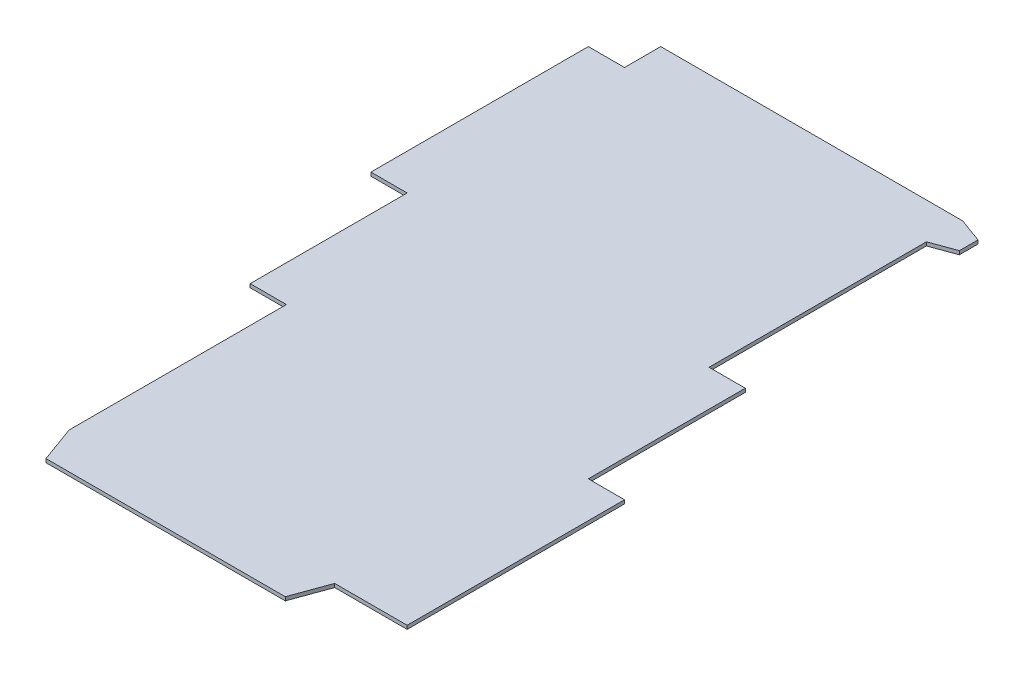
from build123d import *

# Parameters (mm, degrees)
SALIENTE_EXTRUIR1_DEPTH = 1.5


with BuildPart() as part:
    # Croquis1 → Saliente-Extruir1 (new body)
    with BuildSketch(Plane(origin=(0, 0, 0), x_dir=(1, 0, 0), z_dir=(0, 1, 0))):
        Polygon((0, 0), (0, 90), (10, 93.639702343), (10, 101.360297657), (0, 105), (-110, 105), (-125, 105), (-125, 90), (-140, 90), (-140, 0), (-125, 0), (-125, -65), (-110, -65), (-110, -155), (-104.540446486, -170), (-5.459553514, -170), (0, -155), (15, -155), (30, -155), (30, -65), (15, -65), (15, 0), align=None)
    extrude(amount=SALIENTE_EXTRUIR1_DEPTH)


solid = part.part
